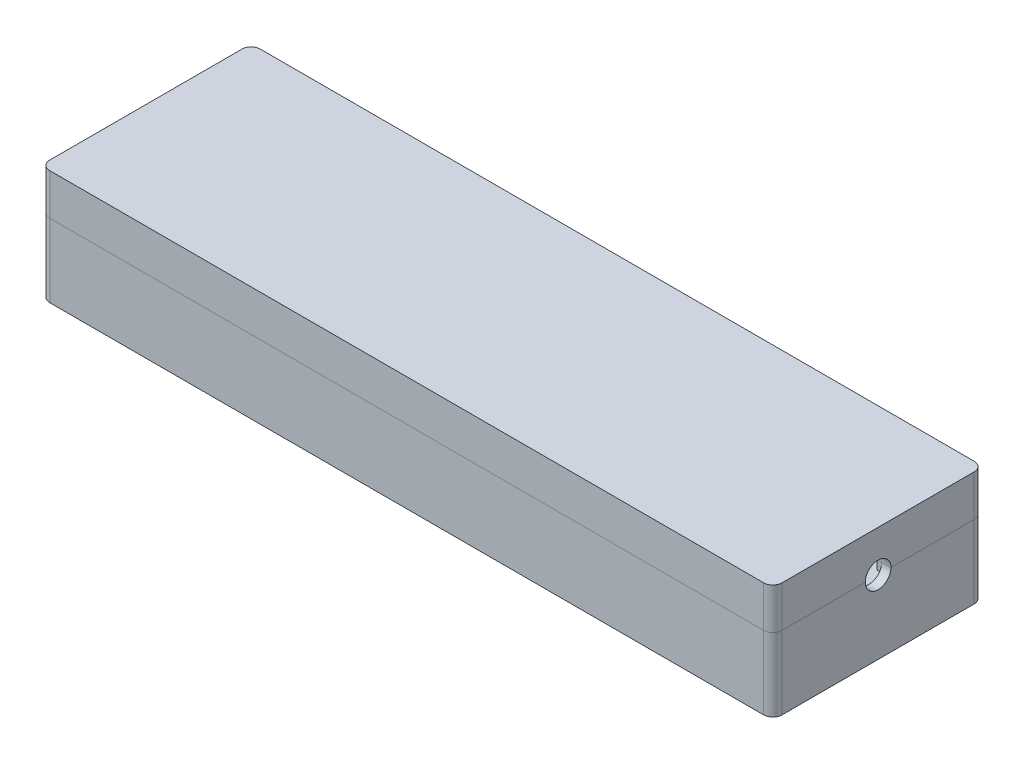
from build123d import *

# Parameters (mm, degrees)
SKETCH1_W           = 80
SKETCH1_H           = 23
BOSS_EXTRUDE1_DEPTH = 8
SKETCH2_W           = 78
SKETCH2_H           = 21
CUT_EXTRUDE1_DEPTH  = 7
CUT_EXTRUDE2_REACH  = 85.624
FILLET1_R           = 1
BOSS_EXTRUDE3_DEPTH = 4.5
CUT_EXTRUDE4_DEPTH  = 3.5
BOSS_EXTRUDE4_START = -1
BOSS_EXTRUDE4_DEPTH = 1
CUT_EXTRUDE3_START  = -1.5
SKETCH4_R           = 1.4
CUT_EXTRUDE3_DEPTH  = 1.5
BOSS_EXTRUDE5_DEPTH = 1.5
SKETCH4_3_W         = 2.8
SKETCH4_3_H         = 1.4
CUT_EXTRUDE19_DEPTH = 1.5
CHAMFER2_SIZE       = 1
CHAMFER3_SIZE       = 1
SKETCH7_W           = 1
SKETCH7_H           = 21
BOSS_EXTRUDE6_DEPTH = 10.5
CUT_EXTRUDE20_DEPTH = 1
FILLET2_R           = 0.5


with BuildPart() as part:
    # Sketch1 → Boss-Extrude1 (new body)
    with BuildSketch(Plane(origin=(0, 0, 0), x_dir=(1, 0, 0), z_dir=(0, 1, 0))):
        with Locations((40, 11.5)):
            Rectangle(SKETCH1_W, SKETCH1_H)
    extrude(amount=BOSS_EXTRUDE1_DEPTH)

    # Sketch2 → Cut-Extrude1 (cut)
    with BuildSketch(Plane(origin=(0, 8, 0), x_dir=(1, 0, 0), z_dir=(0, 1, 0))):
        with Locations((40, 11.5)):
            Rectangle(SKETCH2_W, SKETCH2_H)
    extrude(amount=-CUT_EXTRUDE1_DEPTH, mode=Mode.SUBTRACT)

    # Sketch3 → Cut-Extrude2 (cut, up to next)
    with BuildSketch(Plane(origin=(0, 0, 0), x_dir=(0, 0, -1), z_dir=(1, 0, 0)), mode=Mode.PRIVATE) as cut_extrude2_sk1:
        with BuildLine():
            ThreePointArc((12.715789474, 4.76550704), (12.990684531, 4.701550479), (13.15, 4.934523258))
            Line((13.15, 4.934523258), (13.15, 8))
            Line((13.15, 8), (9.85, 8))
            Line((9.85, 8), (9.85, 4.934523258))
            ThreePointArc((9.85, 4.934523258), (10.009315469, 4.701550479), (10.284210526, 4.76550704))
            ThreePointArc((10.284210526, 4.76550704), (11.5, 5.3), (12.715789474, 4.76550704))
        make_face()
    cut_extrude2_tool1 = extrude(cut_extrude2_sk1.sketch, amount=CUT_EXTRUDE2_REACH, mode=Mode.PRIVATE) & part.part
    # Sketch3 → Cut-Extrude2 (cut, up to next)
    with BuildSketch(Plane(origin=(0, 0, 0), x_dir=(0, 0, -1), z_dir=(1, 0, 0)), mode=Mode.PRIVATE) as cut_extrude2_sk2:
        with BuildLine():
            ThreePointArc((12.715789474, 4.76550704), (13.037620342, 4.248517906), (13.15, 3.65))
            Line((13.15, 3.65), (13.15, 4.934523258))
            ThreePointArc((13.15, 4.934523258), (12.990684531, 4.701550479), (12.715789474, 4.76550704))
        make_face()
    cut_extrude2_tool2 = extrude(cut_extrude2_sk2.sketch, amount=CUT_EXTRUDE2_REACH, mode=Mode.PRIVATE) & part.part
    # Sketch3 → Cut-Extrude2 (cut, up to next)
    with BuildSketch(Plane(origin=(0, 0, 0), x_dir=(0, 0, -1), z_dir=(1, 0, 0)), mode=Mode.PRIVATE) as cut_extrude2_sk3:
        with BuildLine():
            Line((9.85, 4.934523258), (9.85, 3.65))
            ThreePointArc((9.85, 3.65), (9.962379658, 4.248517906), (10.284210526, 4.76550704))
            ThreePointArc((10.284210526, 4.76550704), (10.009315469, 4.701550479), (9.85, 4.934523258))
        make_face()
    cut_extrude2_tool3 = extrude(cut_extrude2_sk3.sketch, amount=CUT_EXTRUDE2_REACH, mode=Mode.PRIVATE) & part.part
    # Sketch3 → Cut-Extrude2 (cut, up to next)
    with BuildSketch(Plane(origin=(0, 0, 0), x_dir=(0, 0, -1), z_dir=(1, 0, 0)), mode=Mode.PRIVATE) as cut_extrude2_sk4:
        with BuildLine():
            ThreePointArc((9.85, 3.65), (11.5, 2), (13.15, 3.65))
            ThreePointArc((13.15, 3.65), (11.5, 5.3), (9.85, 3.65))
        make_face()
    cut_extrude2_tool4 = extrude(cut_extrude2_sk4.sketch, amount=CUT_EXTRUDE2_REACH, mode=Mode.PRIVATE) & part.part
    add(cut_extrude2_tool1.solids().sort_by_distance((0, 6.505264, -11.5))[0], mode=Mode.SUBTRACT)
    add(cut_extrude2_tool2.solids().sort_by_distance((0, 4.466098, -13.044987))[0], mode=Mode.SUBTRACT)
    add(cut_extrude2_tool3.solids().sort_by_distance((0, 4.466098, -9.955013))[0], mode=Mode.SUBTRACT)
    add(cut_extrude2_tool4.solids().sort_by_distance((0, 3.65, -11.5))[0], mode=Mode.SUBTRACT)

    # Fillet1
    fillet1_edges = [part.edges().sort_by_distance(p)[0] for p in [
        (79, 4.5, -1),
        (1, 4.5, -1),
        (1, 4.5, -22),
        (79, 4.5, -22),
        (0, 4, -23),
        (80, 4, -23),
        (80, 4, 0),
        (0, 4, 0),
    ]]
    fillet(fillet1_edges, radius=FILLET1_R)


with BuildPart() as body_2:
    # Sketch6 → Boss-Extrude3 (new body)
    with BuildSketch(Plane(origin=(0, 8, 0), x_dir=(1, 0, 0), z_dir=(0, 1, 0))):
        with BuildLine():
            ThreePointArc((79, 0), (79.707106781, 0.292893219), (80, 1))
            Line((80, 1), (80, 22))
            ThreePointArc((80, 22), (79.707106781, 22.707106781), (79, 23))
            Line((79, 23), (1, 23))
            ThreePointArc((1, 23), (0.292893219, 22.707106781), (0, 22))
            Line((0, 22), (0, 1))
            ThreePointArc((0, 1), (0.292893219, 0.292893219), (1, 0))
            Line((1, 0), (79, 0))
        make_face()
    extrude(amount=BOSS_EXTRUDE3_DEPTH)

    # Sketch6<3> → Cut-Extrude4 (cut)
    with BuildSketch(Plane(origin=(0, 8, 0), x_dir=(1, 0, 0), z_dir=(0, 1, 0))):
        with BuildLine():
            Line((1.5, 21), (1.5, 2))
            ThreePointArc((1.5, 2), (1.646446609, 1.646446609), (2, 1.5))
            Line((2, 1.5), (78, 1.5))
            ThreePointArc((78, 1.5), (78.353553391, 1.646446609), (78.5, 2))
            Line((78.5, 2), (78.5, 21))
            ThreePointArc((78.5, 21), (78.353553391, 21.353553391), (78, 21.5))
            Line((78, 21.5), (2, 21.5))
            ThreePointArc((2, 21.5), (1.646446609, 21.353553391), (1.5, 21))
        make_face()
    extrude(amount=CUT_EXTRUDE4_DEPTH, mode=Mode.SUBTRACT)

    # Sketch6<4> → Boss-Extrude4 (add)
    with BuildSketch(Plane(origin=(0, 8, 0), x_dir=(1, 0, 0), z_dir=(0, 1, 0)).offset(BOSS_EXTRUDE4_START)):
        with BuildLine():
            ThreePointArc((1, 2), (1.292893219, 1.292893219), (2, 1))
            Line((2, 1), (78, 1))
            ThreePointArc((78, 1), (78.707106781, 1.292893219), (79, 2))
            Line((79, 2), (79, 21))
            ThreePointArc((79, 21), (78.707106781, 21.707106781), (78, 22))
            Line((78, 22), (2, 22))
            ThreePointArc((2, 22), (1.292893219, 21.707106781), (1, 21))
            Line((1, 21), (1, 13.15))
            Line((1, 13.15), (1, 9.85))
            Line((1, 9.85), (1, 2))
        make_face()
        with BuildLine():
            Line((78, 1.5), (2, 1.5))
            ThreePointArc((2, 1.5), (1.646446609, 1.646446609), (1.5, 2))
            Line((1.5, 2), (1.5, 21))
            ThreePointArc((1.5, 21), (1.646446609, 21.353553391), (2, 21.5))
            Line((2, 21.5), (78, 21.5))
            ThreePointArc((78, 21.5), (78.353553391, 21.353553391), (78.5, 21))
            Line((78.5, 21), (78.5, 2))
            ThreePointArc((78.5, 2), (78.353553391, 1.646446609), (78, 1.5))
        make_face(mode=Mode.SUBTRACT)
    extrude(amount=BOSS_EXTRUDE4_DEPTH)


with BuildPart() as cut_extrude3_tool:
    # Sketch4 → Cut-Extrude3 (new body)
    with BuildSketch(Plane(origin=(80, 0, 0), x_dir=(0, 0, -1), z_dir=(1, 0, 0)).offset(CUT_EXTRUDE3_START)):
        with Locations((11.5, 8)):
            Circle(SKETCH4_R)
    extrude(amount=CUT_EXTRUDE3_DEPTH)


with BuildPart() as part_1:
    add(part.part)

    # Cut-Extrude3: cut by cut_extrude3_tool
    add(cut_extrude3_tool.part, mode=Mode.SUBTRACT)

    # Chamfer2
    chamfer2_edges = [part_1.edges().sort_by_distance(p)[0] for p in [
        (0.5, 8, -9.85),
        (0.5, 8, -13.15),
    ]]
    chamfer(chamfer2_edges, length=CHAMFER2_SIZE)

    # Sketch7 → Boss-Extrude6 (add)
    with BuildSketch(Plane(origin=(0, 1, 0), x_dir=(1, 0, 0), z_dir=(0, 1, 0))):
        with Locations((58.428, 11.5)):
            Rectangle(SKETCH7_W, SKETCH7_H)
    extrude(amount=BOSS_EXTRUDE6_DEPTH)

    # Sketch8 → Cut-Extrude20 (cut)
    with BuildSketch(Plane.ZY.offset(-57.928)):
        with BuildLine():
            Line((-16, 4.75), (-7, 4.75))
            ThreePointArc((-7, 4.75), (-6.646446609, 4.896446609), (-6.5, 5.25))
            Line((-6.5, 5.25), (-6.5, 11))
            ThreePointArc((-6.5, 11), (-6.353553391, 11.353553391), (-6, 11.5))
            Line((-6, 11.5), (-4.772611503, 11.5))
            ThreePointArc((-4.772611503, 11.5), (-4.533263778, 11.438990509), (-4.352325985, 11.270850667))
            Line((-4.352325985, 11.270850667), (-1.6, 7))
            Line((-1.6, 7), (-1, 7))
            Line((-1, 7), (-1, 13.527800593))
            Line((-1, 13.527800593), (-22, 13.527800593))
            Line((-22, 13.527800593), (-22, 11.5))
            Line((-22, 11.5), (-22, 7))
            Line((-22, 7), (-21.4, 7))
            Line((-21.4, 7), (-18.647674015, 11.270850667))
            ThreePointArc((-18.647674015, 11.270850667), (-18.466736222, 11.438990509), (-18.227388497, 11.5))
            Line((-18.227388497, 11.5), (-17, 11.5))
            ThreePointArc((-17, 11.5), (-16.646446609, 11.353553391), (-16.5, 11))
            Line((-16.5, 11), (-16.5, 5.25))
            ThreePointArc((-16.5, 5.25), (-16.353553391, 4.896446609), (-16, 4.75))
        make_face()
    extrude(amount=-CUT_EXTRUDE20_DEPTH, mode=Mode.SUBTRACT)

    # Fillet2
    fillet2_edges = [part_1.edges().sort_by_distance(p)[0] for p in [
        (57.928, 4, -1),
        (58.928, 4, -1),
        (57.928, 4, -22),
        (58.928, 4, -22),
    ]]
    fillet(fillet2_edges, radius=FILLET2_R)


with BuildPart() as body_2_1:
    add(body_2.part)

    # Cut-Extrude3: cut by cut_extrude3_tool
    add(cut_extrude3_tool.part, mode=Mode.SUBTRACT)

    # Sketch3<3> → Boss-Extrude5 (add)
    with BuildSketch(Plane(origin=(0, 0, 0), x_dir=(0, 0, -1), z_dir=(1, 0, 0))):
        with BuildLine():
            ThreePointArc((12.715789474, 4.76550704), (12.990684531, 4.701550479), (13.15, 4.934523258))
            Line((13.15, 4.934523258), (13.15, 8))
            Line((13.15, 8), (9.85, 8))
            Line((9.85, 8), (9.85, 4.934523258))
            ThreePointArc((9.85, 4.934523258), (10.009315469, 4.701550479), (10.284210526, 4.76550704))
            ThreePointArc((10.284210526, 4.76550704), (11.5, 5.3), (12.715789474, 4.76550704))
        make_face()
    extrude(amount=BOSS_EXTRUDE5_DEPTH)

    # Sketch4<3> → Cut-Extrude19 (cut)
    with BuildSketch(Plane(origin=(80, 0, 0), x_dir=(0, 0, -1), z_dir=(1, 0, 0))):
        with Locations((11.5, 7.3)):
            Rectangle(SKETCH4_3_W, SKETCH4_3_H)
    extrude(amount=-CUT_EXTRUDE19_DEPTH, mode=Mode.SUBTRACT)

    # Chamfer3
    chamfer3_edges = [body_2_1.edges().sort_by_distance(p)[0] for p in [
        (0.5, 8, -9.85),
        (0.5, 8, -13.15),
    ]]
    chamfer(chamfer3_edges, length=CHAMFER3_SIZE)


solid = Compound([part_1.part, body_2_1.part])
